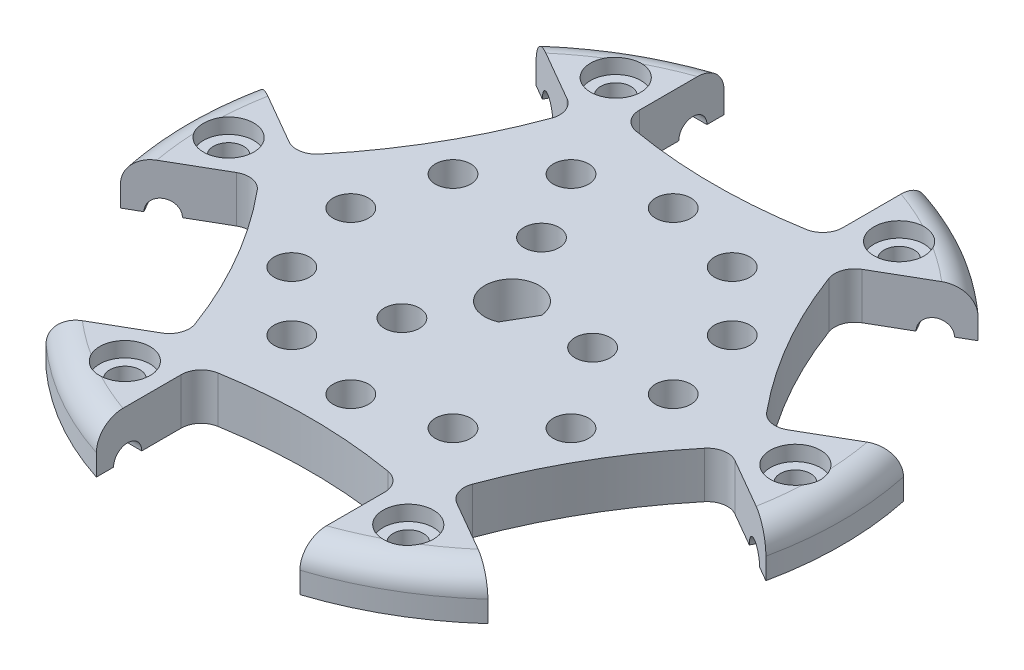
from build123d import *

# Parameters (mm, degrees)
CORTE_EXTRUS_O2_DEPTH  = 10
ESBO_O5_W              = 25.2
ESBO_O5_H              = 1.4
ESBO_O10_W             = 25.2
ESBO_O10_H             = 1.4
ESBO_O12_R             = 1.75
ESBO_O12_R_2           = 1.3
CORTE_EXTRUS_O7_DEPTH  = 46.434293366
ESBO_O15_R             = 1.75
CORTE_EXTRUS_O8_DEPTH  = 46.434293366
CORTE_EXTRUS_O9_DEPTH  = 46.434293366
ESBO_O16_R             = 2.05
CORTE_EXTRUS_O10_DEPTH = 1.5
ESBO_O17_R             = 1.5
CORTE_EXTRUS_O11_DEPTH = 46.434293366
ESBO_O18_R             = 2.5
CORTE_EXTRUS_O12_DEPTH = 1.5
CORTE_EXTRUS_O13_DEPTH = 46.434293366


with BuildPart() as part:
    # Esboço1 → Revolução3 (revolve)
    with BuildSketch(Plane.XY, mode=Mode.PRIVATE) as revolu_o3_sk:
        with BuildLine():
            Line((-32.75, 2.1), (-32.75, 0))
            Line((-32.75, 0), (0, 0))
            Line((0, 0), (0, 4.6))
            Line((0, 4.6), (-6.07, 4.6))
            Line((-6.07, 4.6), (-30.25, 4.6))
            ThreePointArc((-30.25, 4.6), (-32.017766953, 3.867766953), (-32.75, 2.1))
        make_face()
    revolve(revolu_o3_sk.sketch.rotate(Axis((0, 0, 0), (0, 1, 0)), 270), axis=Axis((0, 0, 0), (0, 1, 0)))

    # Esboço3 → Corte-extrusão2 (cut)
    with BuildSketch(Plane.XZ):
        with BuildLine():
            Line((-10.1, 71.55), (10.1, 71.55))
            Line((10.1, 71.55), (10.1, 22.738373522))
            ThreePointArc((10.1, 22.738373522), (9.628888485, 21.448993826), (8.4375, 20.767055752))
            ThreePointArc((8.4375, 20.767055752), (0, 20.05), (-8.4375, 20.767055752))
            ThreePointArc((-8.4375, 20.767055752), (-9.628888485, 21.448993826), (-10.1, 22.738373522))
            Line((-10.1, 22.738373522), (-10.1, 71.55))
        make_face()
        with BuildLine():
            Line((10.1, -71.55), (-10.1, -71.55))
            Line((-10.1, -71.55), (-10.1, -22.738373522))
            ThreePointArc((-10.1, -22.738373522), (-9.628888485, -21.448993826), (-8.4375, -20.767055752))
            ThreePointArc((-8.4375, -20.767055752), (0, -20.05), (8.4375, -20.767055752))
            ThreePointArc((8.4375, -20.767055752), (9.628888485, -21.448993826), (10.1, -22.738373522))
            Line((10.1, -22.738373522), (10.1, -71.55))
        make_face()
        with BuildLine():
            Line((56.914117641, 44.521856578), (67.014117641, 27.028143422))
            Line((67.014117641, 27.028143422), (24.742009111, 2.622330183))
            ThreePointArc((24.742009111, 2.622330183), (23.389817782, 2.385634875), (22.203547843, 3.076438532))
            ThreePointArc((22.203547843, 3.076438532), (17.363809346, 10.025), (13.766047843, 17.69061722))
            ThreePointArc((13.766047843, 17.69061722), (13.760929296, 19.063358951), (14.642009111, 20.116043339))
            Line((14.642009111, 20.116043339), (56.914117641, 44.521856578))
        make_face()
        with BuildLine():
            Line((-56.914117641, -44.521856578), (-67.014117641, -27.028143422))
            Line((-67.014117641, -27.028143422), (-24.742009111, -2.622330183))
            ThreePointArc((-24.742009111, -2.622330183), (-23.389817782, -2.385634875), (-22.203547843, -3.076438532))
            ThreePointArc((-22.203547843, -3.076438532), (-17.363809346, -10.025), (-13.766047843, -17.69061722))
            ThreePointArc((-13.766047843, -17.69061722), (-13.760929296, -19.063358951), (-14.642009111, -20.116043339))
            Line((-14.642009111, -20.116043339), (-56.914117641, -44.521856578))
        make_face()
        with BuildLine():
            Line((-67.014117641, 27.028143422), (-56.914117641, 44.521856578))
            Line((-56.914117641, 44.521856578), (-14.642009111, 20.116043339))
            ThreePointArc((-14.642009111, 20.116043339), (-13.760929296, 19.063358951), (-13.766047843, 17.69061722))
            ThreePointArc((-13.766047843, 17.69061722), (-17.363809346, 10.025), (-22.203547843, 3.076438532))
            ThreePointArc((-22.203547843, 3.076438532), (-23.389817782, 2.385634875), (-24.742009111, 2.622330183))
            Line((-24.742009111, 2.622330183), (-67.014117641, 27.028143422))
        make_face()
        with BuildLine():
            Line((67.014117641, -27.028143422), (56.914117641, -44.521856578))
            Line((56.914117641, -44.521856578), (14.642009111, -20.116043339))
            ThreePointArc((14.642009111, -20.116043339), (13.760929296, -19.063358951), (13.766047843, -17.69061722))
            ThreePointArc((13.766047843, -17.69061722), (17.363809346, -10.025), (22.203547843, -3.076438532))
            ThreePointArc((22.203547843, -3.076438532), (23.389817782, -2.385634875), (24.742009111, -2.622330183))
            Line((24.742009111, -2.622330183), (67.014117641, -27.028143422))
        make_face()
    extrude(amount=-CORTE_EXTRUS_O2_DEPTH, mode=Mode.SUBTRACT)

    # Esboço5 → Corte-Revolução3 (revolve, cut)
    with BuildSketch(Plane.XZ):
        with Locations((0, 27.35)):
            Rectangle(ESBO_O5_W, ESBO_O5_H)
    revolve(axis=Axis((-12.6, 0, 28.05), (1, 0, 0)), mode=Mode.SUBTRACT)

    # Esboço6 → Corte-Revolução4 (revolve, cut)
    with BuildSketch(Plane.XZ):
        Polygon((-29.379577011, 2.413079912), (-16.779577011, 24.236920088), (-17.992012576, 24.936920088), (-30.592012576, 3.113079912), align=None)
    revolve(axis=Axis((-30.592012576, 0, 3.113079912), (0.49999999999999983, 0, 0.8660254037844388)), mode=Mode.SUBTRACT)

    # Esboço7 → Corte-Revolução5 (revolve, cut)
    with BuildSketch(Plane.XZ):
        Polygon((-16.779577011, -24.236920088), (-29.379577011, -2.413079912), (-30.592012576, -3.113079912), (-17.992012576, -24.936920088), align=None)
    revolve(axis=Axis((-17.992012576, 0, -24.936920088), (-0.4999999999999998, 0, 0.8660254037844388)), mode=Mode.SUBTRACT)

    # Esboço8 → Corte-Revolução6 (revolve, cut)
    with BuildSketch(Plane.XZ):
        Polygon((16.779577011, 24.236920088), (29.379577011, 2.413079912), (30.592012576, 3.113079912), (17.992012576, 24.936920088), align=None)
    revolve(axis=Axis((17.992012576, 0, 24.936920088), (0.5000000000000001, 0, -0.8660254037844386)), mode=Mode.SUBTRACT)

    # Esboço10 → Corte-Revolução7 (revolve, cut)
    with BuildSketch(Plane.XZ):
        with Locations((0, -27.35)):
            Rectangle(ESBO_O10_W, ESBO_O10_H)
    revolve(axis=Axis((12.6, 0, -28.05), (-1, 0, 0)), mode=Mode.SUBTRACT)

    # Esboço11 → Corte-Revolução8 (revolve, cut)
    with BuildSketch(Plane.XZ):
        Polygon((29.379577011, -2.413079912), (16.779577011, -24.236920088), (17.992012576, -24.936920088), (30.592012576, -3.113079912), align=None)
    revolve(axis=Axis((30.592012576, 0, -3.113079912), (-0.49999999999999994, 0, -0.8660254037844387)), mode=Mode.SUBTRACT)

    # Esboço12 → Corte-extrusão7 (cut, through all)
    with BuildSketch(Plane.XZ):
        with Locations(Location((0, 16, 0), (0, 0, 270))):
            Circle(ESBO_O12_R)
        with Locations(Location((-8, 13.856406461, 0), (0, 0, 270))):
            Circle(ESBO_O12_R)
        with Locations(Location((-13.856406461, 8, 0), (0, 0, 270))):
            Circle(ESBO_O12_R)
        with Locations(Location((-16, 0, 0), (0, 0, 270))):
            Circle(ESBO_O12_R)
        with Locations(Location((-13.856406461, -8, 0), (0, 0, 270))):
            Circle(ESBO_O12_R)
        with Locations(Location((-8, -13.856406461, 0), (0, 0, 270))):
            Circle(ESBO_O12_R)
        with Locations(Location((0, -16, 0), (0, 0, 270))):
            Circle(ESBO_O12_R)
        with Locations(Location((8, -13.856406461, 0), (0, 0, 270))):
            Circle(ESBO_O12_R)
        with Locations(Location((13.856406461, -8, 0), (0, 0, 270))):
            Circle(ESBO_O12_R)
        with Locations(Location((16, 0, 0), (0, 0, 270))):
            Circle(ESBO_O12_R)
        with Locations(Location((13.856406461, 8, 0), (0, 0, 270))):
            Circle(ESBO_O12_R)
        with Locations(Location((8, 13.856406461, 0), (0, 0, 270))):
            Circle(ESBO_O12_R)
        with Locations(Location((28.129577011, 0, 0), (0, 0, 270))):
            Circle(ESBO_O12_R_2)
        with Locations(Location((14.064788505, 24.360928289, 0), (0, 0, 270))):
            Circle(ESBO_O12_R_2)
        with Locations(Location((-14.064788505, 24.360928289, 0), (0, 0, 270))):
            Circle(ESBO_O12_R_2)
        with Locations(Location((-28.129577011, 0, 0), (0, 0, 270))):
            Circle(ESBO_O12_R_2)
        with Locations(Location((14.064788505, -24.360928289, 0), (0, 0, 270))):
            Circle(ESBO_O12_R_2)
        with Locations(Location((-14.064788505, -24.360928289, 0), (0, 0, 270))):
            Circle(ESBO_O12_R_2)
    extrude(amount=-CORTE_EXTRUS_O7_DEPTH, mode=Mode.SUBTRACT)

    # Esboço15 → Corte-extrusão8 (cut, through all)
    with BuildSketch(Plane(origin=(0, 4.6, 0), x_dir=(1, 0, 0), z_dir=(0, 1, 0))):
        with Locations(Location((-4, -6.92820323, 0), (0, 0, 270))):
            Circle(ESBO_O15_R)
        with Locations(Location((8, 0, 0), (0, 0, 270))):
            Circle(ESBO_O15_R)
        with Locations(Location((-4, 6.92820323, 0), (0, 0, 270))):
            Circle(ESBO_O15_R)
    extrude(amount=-CORTE_EXTRUS_O8_DEPTH, mode=Mode.SUBTRACT)

    # Esboço14 → Corte-extrusão9 (cut, through all)
    with BuildSketch(Plane.XZ):
        with BuildLine():
            Line((1.052167862, 2.377591805), (2.585138834, -0.277591805))
            ThreePointArc((2.585138834, -0.277591805), (-2.25166605, -1.3), (1.052167862, 2.377591805))
        make_face()
    extrude(amount=-CORTE_EXTRUS_O9_DEPTH, mode=Mode.SUBTRACT)

    # Esboço16 → Corte-extrusão10 (cut)
    with BuildSketch(Plane(origin=(0, 4.6, 0), x_dir=(1, 0, 0), z_dir=(0, 1, 0))):
        with Locations(Location((-14.064788505, 24.360928289, 0), (0, 0, 270))):
            Circle(ESBO_O16_R)
        with Locations(Location((-28.129577011, 0, 0), (0, 0, 270))):
            Circle(ESBO_O16_R)
        with Locations(Location((-14.064788505, -24.360928289, 0), (0, 0, 270))):
            Circle(ESBO_O16_R)
        with Locations(Location((14.064788505, -24.360928289, 0), (0, 0, 270))):
            Circle(ESBO_O16_R)
        with Locations(Location((28.129577011, 0, 0), (0, 0, 270))):
            Circle(ESBO_O16_R)
        with Locations(Location((14.064788505, 24.360928289, 0), (0, 0, 270))):
            Circle(ESBO_O16_R)
    extrude(amount=-CORTE_EXTRUS_O10_DEPTH, mode=Mode.SUBTRACT)

    # Esboço17 → Corte-extrusão11 (cut, through all)
    with BuildSketch(Plane(origin=(0, 4.6, 0), x_dir=(1, 0, 0), z_dir=(0, 1, 0))):
        with Locations(Location((-14.064788505, 24.360928289, 0), (0, 0, 270))):
            Circle(ESBO_O17_R)
        with Locations(Location((14.064788505, 24.360928289, 0), (0, 0, 270))):
            Circle(ESBO_O17_R)
        with Locations(Location((-14.064788505, -24.360928289, 0), (0, 0, 270))):
            Circle(ESBO_O17_R)
        with Locations(Location((14.064788505, -24.360928289, 0), (0, 0, 270))):
            Circle(ESBO_O17_R)
        with Locations(Location((-28.129577011, 0, 0), (0, 0, 270))):
            Circle(ESBO_O17_R)
        with Locations(Location((28.129577011, 0, 0), (0, 0, 270))):
            Circle(ESBO_O17_R)
    extrude(amount=-CORTE_EXTRUS_O11_DEPTH, mode=Mode.SUBTRACT)

    # Esboço18 → Corte-extrusão12 (cut)
    with BuildSketch(Plane(origin=(0, 4.6, 0), x_dir=(1, 0, 0), z_dir=(0, 1, 0))):
        with Locations(Location((-14.064788505, 24.360928289, 0), (0, 0, 270))):
            Circle(ESBO_O18_R)
        with Locations(Location((14.064788505, 24.360928289, 0), (0, 0, 270))):
            Circle(ESBO_O18_R)
        with Locations(Location((14.064788505, -24.360928289, 0), (0, 0, 270))):
            Circle(ESBO_O18_R)
        with Locations(Location((-14.064788505, -24.360928289, 0), (0, 0, 270))):
            Circle(ESBO_O18_R)
        with Locations(Location((-28.129577011, 0, 0), (0, 0, 270))):
            Circle(ESBO_O18_R)
        with Locations(Location((28.129577011, 0, 0), (0, 0, 270))):
            Circle(ESBO_O18_R)
    extrude(amount=-CORTE_EXTRUS_O12_DEPTH, mode=Mode.SUBTRACT)

    # Esboço19 → Corte-extrusão13 (cut, through all)
    with BuildSketch(Plane(origin=(0, 4.6, 0), x_dir=(1, 0, 0), z_dir=(0, 1, 0))):
        with BuildLine():
            Line((1.122632096, -2.455544171), (2.68787968, 0.255544171))
            ThreePointArc((2.68787968, 0.255544171), (-2.33826859, 1.35), (1.122632096, -2.455544171))
        make_face()
    extrude(amount=-CORTE_EXTRUS_O13_DEPTH, mode=Mode.SUBTRACT)


solid = part.part
